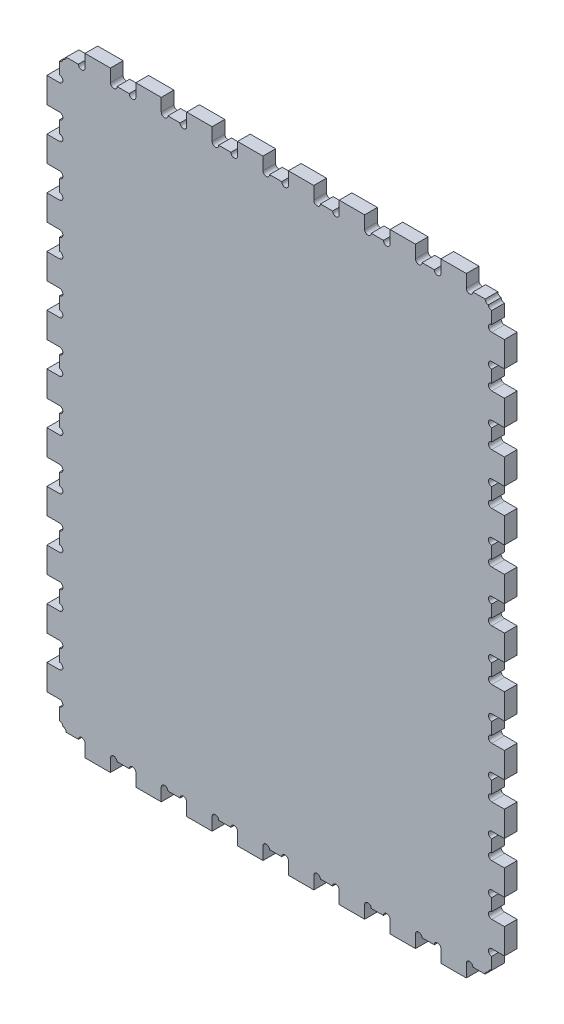
from build123d import *

# Parameters (mm, degrees)
SKETCH1_W                = 457.2
SKETCH1_H                = 609.6
BOSS_EXTRUDE1_DEPTH      = 12.7
CUT_EXTRUDE1_DEPTH       = 382.211607903
LPATTERN1_COUNT          = 9
LPATTERN1_PITCH          = 50.8
SKETCH6_W                = 12.7
SKETCH6_H                = 12.7
CUT_EXTRUDE4_DEPTH       = 382.211607903
SKETCH3_R                = 3.302
SKETCH3_W                = 12.7
SKETCH3_H                = 25.4
CUT_EXTRUDE2_DEPTH       = 382.211607903
LPATTERN2_COUNT          = 12
LPATTERN2_PITCH          = 50.8
MIRROR7_COPY_1_SKETCH_W  = 12.7
MIRROR7_COPY_1_SKETCH_H  = 12.7
MIRROR7_COPY_1_DEPTH     = 382.211607903
MIRROR1_COPY_1_SKETCH_R  = 3.302
MIRROR1_COPY_1_SKETCH_W  = 12.7
MIRROR1_COPY_1_SKETCH_H  = 25.4
MIRROR1_COPY_1_DEPTH     = 382.211607903
MIRROR1_COPY_2_SKETCH_R  = 3.302
MIRROR1_COPY_2_SKETCH_W  = 12.7
MIRROR1_COPY_2_SKETCH_H  = 25.4
MIRROR1_COPY_2_DEPTH     = 382.211607903
MIRROR1_COPY_3_SKETCH_R  = 3.302
MIRROR1_COPY_3_SKETCH_W  = 12.7
MIRROR1_COPY_3_SKETCH_H  = 25.4
MIRROR1_COPY_3_DEPTH     = 382.211607903
MIRROR1_COPY_4_SKETCH_R  = 3.302
MIRROR1_COPY_4_SKETCH_W  = 12.7
MIRROR1_COPY_4_SKETCH_H  = 25.4
MIRROR1_COPY_4_DEPTH     = 382.211607903
MIRROR1_COPY_5_SKETCH_R  = 3.302
MIRROR1_COPY_5_SKETCH_W  = 12.7
MIRROR1_COPY_5_SKETCH_H  = 25.4
MIRROR1_COPY_5_DEPTH     = 382.211607903
MIRROR1_COPY_6_SKETCH_R  = 3.302
MIRROR1_COPY_6_SKETCH_W  = 12.7
MIRROR1_COPY_6_SKETCH_H  = 25.4
MIRROR1_COPY_6_DEPTH     = 382.211607903
MIRROR1_COPY_7_SKETCH_R  = 3.302
MIRROR1_COPY_7_SKETCH_W  = 12.7
MIRROR1_COPY_7_SKETCH_H  = 25.4
MIRROR1_COPY_7_DEPTH     = 382.211607903
MIRROR1_COPY_8_SKETCH_R  = 3.302
MIRROR1_COPY_8_SKETCH_W  = 12.7
MIRROR1_COPY_8_SKETCH_H  = 25.4
MIRROR1_COPY_8_DEPTH     = 382.211607903
MIRROR1_COPY_9_SKETCH_R  = 3.302
MIRROR1_COPY_9_SKETCH_W  = 12.7
MIRROR1_COPY_9_SKETCH_H  = 25.4
MIRROR1_COPY_9_DEPTH     = 382.211607903
MIRROR1_COPY_10_SKETCH_R = 3.302
MIRROR1_COPY_10_SKETCH_W = 12.7
MIRROR1_COPY_10_SKETCH_H = 25.4
MIRROR1_COPY_10_DEPTH    = 382.211607903
MIRROR1_COPY_11_SKETCH_R = 3.302
MIRROR1_COPY_11_SKETCH_W = 12.7
MIRROR1_COPY_11_SKETCH_H = 25.4
MIRROR1_COPY_11_DEPTH    = 382.211607903
MIRROR2_COPY_1_DEPTH     = 382.211607903
MIRROR2_COPY_2_DEPTH     = 382.211607903
MIRROR2_COPY_3_DEPTH     = 382.211607903
MIRROR2_COPY_4_DEPTH     = 382.211607903
MIRROR2_COPY_5_DEPTH     = 382.211607903
MIRROR2_COPY_6_DEPTH     = 382.211607903
MIRROR2_COPY_7_DEPTH     = 382.211607903
MIRROR2_COPY_8_DEPTH     = 382.211607903
SKETCH5_W                = 25.4
SKETCH5_H                = 12.7
SKETCH5_W_2              = 12.7
SKETCH5_H_2              = 25.4
CUT_EXTRUDE3_DEPTH       = 382.211607903


with BuildPart() as part:
    # Sketch1 → Boss-Extrude1 (new body)
    with BuildSketch(Plane.XY):
        Rectangle(SKETCH1_W, SKETCH1_H)
    extrude(amount=BOSS_EXTRUDE1_DEPTH)

    # Sketch2 → Cut-Extrude1 (cut, through all)
    with BuildSketch(Plane.XY.offset(12.7)):
        with BuildLine():
            Line((-190.5, 304.8), (-215.9, 304.8))
            Line((-215.9, 304.8), (-215.9, 292.1))
            ThreePointArc((-215.9, 292.1), (-212.598, 295.402), (-209.296, 292.1))
            Line((-209.296, 292.1), (-197.104, 292.1))
            ThreePointArc((-197.104, 292.1), (-193.802, 295.402), (-190.5, 292.1))
            Line((-190.5, 292.1), (-190.5, 304.8))
        make_face()
        with BuildLine():
            ThreePointArc((-209.296, 292.1), (-212.598, 295.402), (-215.9, 292.1))
            Line((-215.9, 292.1), (-209.296, 292.1))
        make_face()
        with BuildLine():
            Line((-209.296, 292.1), (-215.9, 292.1))
            ThreePointArc((-215.9, 292.1), (-212.598, 288.798), (-209.296, 292.1))
        make_face()
        with BuildLine():
            ThreePointArc((-197.104, 292.1), (-193.802, 288.798), (-190.5, 292.1))
            Line((-190.5, 292.1), (-197.104, 292.1))
        make_face()
        with BuildLine():
            Line((-197.104, 292.1), (-190.5, 292.1))
            ThreePointArc((-190.5, 292.1), (-193.802, 295.402), (-197.104, 292.1))
        make_face()
    cut_extrude1 = extrude(amount=-CUT_EXTRUDE1_DEPTH, mode=Mode.SUBTRACT)

    # LPattern1: Cut-Extrude1 ×9
    with Locations(*[(i * LPATTERN1_PITCH, 0, 0) for i in range(1, LPATTERN1_COUNT)]):
        add(cut_extrude1, mode=Mode.SUBTRACT)

    # Sketch6 → Cut-Extrude4 (cut, through all)
    with BuildSketch(Plane.XY.offset(12.7)):
        with Locations((-222.25, 298.45)):
            Rectangle(SKETCH6_W, SKETCH6_H)
    cut_extrude4 = extrude(amount=-CUT_EXTRUDE4_DEPTH, mode=Mode.SUBTRACT)

    # Sketch3 → Cut-Extrude2 (cut, through all)
    with BuildSketch(Plane.XY.offset(12.7)):
        with Locations((-215.9, 270.002)):
            Circle(SKETCH3_R)
        with Locations((-215.9, 288.798)):
            Circle(SKETCH3_R)
        with Locations((-222.25, 279.4)):
            Rectangle(SKETCH3_W, SKETCH3_H)
        with BuildLine():
            ThreePointArc((-212.598, 288.798), (-213.565133409, 291.132866591), (-215.9, 292.1))
            Line((-215.9, 292.1), (-215.9, 285.496))
            ThreePointArc((-215.9, 285.496), (-213.565133409, 286.463133409), (-212.598, 288.798))
        make_face()
        with BuildLine():
            Line((-215.9, 285.496), (-215.9, 292.1))
            ThreePointArc((-215.9, 292.1), (-219.202, 288.798), (-215.9, 285.496))
        make_face()
        with BuildLine():
            ThreePointArc((-215.9, 273.304), (-219.202, 270.002), (-215.9, 266.7))
            Line((-215.9, 266.7), (-215.9, 273.304))
        make_face()
        with BuildLine():
            Line((-215.9, 273.304), (-215.9, 266.7))
            ThreePointArc((-215.9, 266.7), (-213.565133409, 267.667133409), (-212.598, 270.002))
            ThreePointArc((-212.598, 270.002), (-213.565133409, 272.336866591), (-215.9, 273.304))
        make_face()
    cut_extrude2 = extrude(amount=-CUT_EXTRUDE2_DEPTH, mode=Mode.SUBTRACT)

    # LPattern2: Cut-Extrude2 ×12
    with Locations(*[(0, -i * LPATTERN2_PITCH, 0) for i in range(1, LPATTERN2_COUNT)]):
        add(cut_extrude2, mode=Mode.SUBTRACT)

    # Mirror6: Cut-Extrude4 across plane
    add(cut_extrude4.mirror(Plane(origin=(0, 0, 0), x_dir=(0, 0, 1), z_dir=(1, 0, 0))), mode=Mode.SUBTRACT)

    # Mirror7: Cut-Extrude4 across plane
    add(cut_extrude4.mirror(Plane.ZX), mode=Mode.SUBTRACT)

    # Mirror7 copy 1 sketch → Mirror7 copy 1 (cut, through all)
    with BuildSketch(Plane(origin=(0, 0, 12.7), x_dir=(-1, 0, 0), z_dir=(0, 0, 1))):
        with Locations((-222.25, 298.45)):
            Rectangle(MIRROR7_COPY_1_SKETCH_W, MIRROR7_COPY_1_SKETCH_H)
    extrude(amount=-MIRROR7_COPY_1_DEPTH, mode=Mode.SUBTRACT)

    # Mirror1: Cut-Extrude2 across plane
    add(cut_extrude2.mirror(Plane(origin=(0, 0, 0), x_dir=(0, 0, 1), z_dir=(1, 0, 0))), mode=Mode.SUBTRACT)

    # Mirror1 copy 1 sketch → Mirror1 copy 1 (cut, through all)
    with BuildSketch(Plane(origin=(0, -50.8, 12.7), x_dir=(-1, 0, 0), z_dir=(0, 0, 1))):
        with Locations((-215.9, -270.002)):
            Circle(MIRROR1_COPY_1_SKETCH_R)
        with Locations((-215.9, -288.798)):
            Circle(MIRROR1_COPY_1_SKETCH_R)
        with Locations((-222.25, -279.4)):
            Rectangle(MIRROR1_COPY_1_SKETCH_W, MIRROR1_COPY_1_SKETCH_H)
        with BuildLine():
            ThreePointArc((-212.598, -288.798), (-213.565133409, -291.132866591), (-215.9, -292.1))
            Line((-215.9, -292.1), (-215.9, -285.496))
            ThreePointArc((-215.9, -285.496), (-213.565133409, -286.463133409), (-212.598, -288.798))
        make_face()
        with BuildLine():
            Line((-215.9, -285.496), (-215.9, -292.1))
            ThreePointArc((-215.9, -292.1), (-219.202, -288.798), (-215.9, -285.496))
        make_face()
        with BuildLine():
            ThreePointArc((-215.9, -273.304), (-219.202, -270.002), (-215.9, -266.7))
            Line((-215.9, -266.7), (-215.9, -273.304))
        make_face()
        with BuildLine():
            Line((-215.9, -273.304), (-215.9, -266.7))
            ThreePointArc((-215.9, -266.7), (-213.565133409, -267.667133409), (-212.598, -270.002))
            ThreePointArc((-212.598, -270.002), (-213.565133409, -272.336866591), (-215.9, -273.304))
        make_face()
    extrude(amount=-MIRROR1_COPY_1_DEPTH, mode=Mode.SUBTRACT)

    # Mirror1 copy 2 sketch → Mirror1 copy 2 (cut, through all)
    with BuildSketch(Plane(origin=(0, -101.6, 12.7), x_dir=(-1, 0, 0), z_dir=(0, 0, 1))):
        with Locations((-215.9, -270.002)):
            Circle(MIRROR1_COPY_2_SKETCH_R)
        with Locations((-215.9, -288.798)):
            Circle(MIRROR1_COPY_2_SKETCH_R)
        with Locations((-222.25, -279.4)):
            Rectangle(MIRROR1_COPY_2_SKETCH_W, MIRROR1_COPY_2_SKETCH_H)
        with BuildLine():
            ThreePointArc((-212.598, -288.798), (-213.565133409, -291.132866591), (-215.9, -292.1))
            Line((-215.9, -292.1), (-215.9, -285.496))
            ThreePointArc((-215.9, -285.496), (-213.565133409, -286.463133409), (-212.598, -288.798))
        make_face()
        with BuildLine():
            Line((-215.9, -285.496), (-215.9, -292.1))
            ThreePointArc((-215.9, -292.1), (-219.202, -288.798), (-215.9, -285.496))
        make_face()
        with BuildLine():
            ThreePointArc((-215.9, -273.304), (-219.202, -270.002), (-215.9, -266.7))
            Line((-215.9, -266.7), (-215.9, -273.304))
        make_face()
        with BuildLine():
            Line((-215.9, -273.304), (-215.9, -266.7))
            ThreePointArc((-215.9, -266.7), (-213.565133409, -267.667133409), (-212.598, -270.002))
            ThreePointArc((-212.598, -270.002), (-213.565133409, -272.336866591), (-215.9, -273.304))
        make_face()
    extrude(amount=-MIRROR1_COPY_2_DEPTH, mode=Mode.SUBTRACT)

    # Mirror1 copy 3 sketch → Mirror1 copy 3 (cut, through all)
    with BuildSketch(Plane(origin=(0, -152.4, 12.7), x_dir=(-1, 0, 0), z_dir=(0, 0, 1))):
        with Locations((-215.9, -270.002)):
            Circle(MIRROR1_COPY_3_SKETCH_R)
        with Locations((-215.9, -288.798)):
            Circle(MIRROR1_COPY_3_SKETCH_R)
        with Locations((-222.25, -279.4)):
            Rectangle(MIRROR1_COPY_3_SKETCH_W, MIRROR1_COPY_3_SKETCH_H)
        with BuildLine():
            ThreePointArc((-212.598, -288.798), (-213.565133409, -291.132866591), (-215.9, -292.1))
            Line((-215.9, -292.1), (-215.9, -285.496))
            ThreePointArc((-215.9, -285.496), (-213.565133409, -286.463133409), (-212.598, -288.798))
        make_face()
        with BuildLine():
            Line((-215.9, -285.496), (-215.9, -292.1))
            ThreePointArc((-215.9, -292.1), (-219.202, -288.798), (-215.9, -285.496))
        make_face()
        with BuildLine():
            ThreePointArc((-215.9, -273.304), (-219.202, -270.002), (-215.9, -266.7))
            Line((-215.9, -266.7), (-215.9, -273.304))
        make_face()
        with BuildLine():
            Line((-215.9, -273.304), (-215.9, -266.7))
            ThreePointArc((-215.9, -266.7), (-213.565133409, -267.667133409), (-212.598, -270.002))
            ThreePointArc((-212.598, -270.002), (-213.565133409, -272.336866591), (-215.9, -273.304))
        make_face()
    extrude(amount=-MIRROR1_COPY_3_DEPTH, mode=Mode.SUBTRACT)

    # Mirror1 copy 4 sketch → Mirror1 copy 4 (cut, through all)
    with BuildSketch(Plane(origin=(0, -203.2, 12.7), x_dir=(-1, 0, 0), z_dir=(0, 0, 1))):
        with Locations((-215.9, -270.002)):
            Circle(MIRROR1_COPY_4_SKETCH_R)
        with Locations((-215.9, -288.798)):
            Circle(MIRROR1_COPY_4_SKETCH_R)
        with Locations((-222.25, -279.4)):
            Rectangle(MIRROR1_COPY_4_SKETCH_W, MIRROR1_COPY_4_SKETCH_H)
        with BuildLine():
            ThreePointArc((-212.598, -288.798), (-213.565133409, -291.132866591), (-215.9, -292.1))
            Line((-215.9, -292.1), (-215.9, -285.496))
            ThreePointArc((-215.9, -285.496), (-213.565133409, -286.463133409), (-212.598, -288.798))
        make_face()
        with BuildLine():
            Line((-215.9, -285.496), (-215.9, -292.1))
            ThreePointArc((-215.9, -292.1), (-219.202, -288.798), (-215.9, -285.496))
        make_face()
        with BuildLine():
            ThreePointArc((-215.9, -273.304), (-219.202, -270.002), (-215.9, -266.7))
            Line((-215.9, -266.7), (-215.9, -273.304))
        make_face()
        with BuildLine():
            Line((-215.9, -273.304), (-215.9, -266.7))
            ThreePointArc((-215.9, -266.7), (-213.565133409, -267.667133409), (-212.598, -270.002))
            ThreePointArc((-212.598, -270.002), (-213.565133409, -272.336866591), (-215.9, -273.304))
        make_face()
    extrude(amount=-MIRROR1_COPY_4_DEPTH, mode=Mode.SUBTRACT)

    # Mirror1 copy 5 sketch → Mirror1 copy 5 (cut, through all)
    with BuildSketch(Plane(origin=(0, -254, 12.7), x_dir=(-1, 0, 0), z_dir=(0, 0, 1))):
        with Locations((-215.9, -270.002)):
            Circle(MIRROR1_COPY_5_SKETCH_R)
        with Locations((-215.9, -288.798)):
            Circle(MIRROR1_COPY_5_SKETCH_R)
        with Locations((-222.25, -279.4)):
            Rectangle(MIRROR1_COPY_5_SKETCH_W, MIRROR1_COPY_5_SKETCH_H)
        with BuildLine():
            ThreePointArc((-212.598, -288.798), (-213.565133409, -291.132866591), (-215.9, -292.1))
            Line((-215.9, -292.1), (-215.9, -285.496))
            ThreePointArc((-215.9, -285.496), (-213.565133409, -286.463133409), (-212.598, -288.798))
        make_face()
        with BuildLine():
            Line((-215.9, -285.496), (-215.9, -292.1))
            ThreePointArc((-215.9, -292.1), (-219.202, -288.798), (-215.9, -285.496))
        make_face()
        with BuildLine():
            ThreePointArc((-215.9, -273.304), (-219.202, -270.002), (-215.9, -266.7))
            Line((-215.9, -266.7), (-215.9, -273.304))
        make_face()
        with BuildLine():
            Line((-215.9, -273.304), (-215.9, -266.7))
            ThreePointArc((-215.9, -266.7), (-213.565133409, -267.667133409), (-212.598, -270.002))
            ThreePointArc((-212.598, -270.002), (-213.565133409, -272.336866591), (-215.9, -273.304))
        make_face()
    extrude(amount=-MIRROR1_COPY_5_DEPTH, mode=Mode.SUBTRACT)

    # Mirror1 copy 6 sketch → Mirror1 copy 6 (cut, through all)
    with BuildSketch(Plane(origin=(0, -304.8, 12.7), x_dir=(-1, 0, 0), z_dir=(0, 0, 1))):
        with Locations((-215.9, -270.002)):
            Circle(MIRROR1_COPY_6_SKETCH_R)
        with Locations((-215.9, -288.798)):
            Circle(MIRROR1_COPY_6_SKETCH_R)
        with Locations((-222.25, -279.4)):
            Rectangle(MIRROR1_COPY_6_SKETCH_W, MIRROR1_COPY_6_SKETCH_H)
        with BuildLine():
            ThreePointArc((-212.598, -288.798), (-213.565133409, -291.132866591), (-215.9, -292.1))
            Line((-215.9, -292.1), (-215.9, -285.496))
            ThreePointArc((-215.9, -285.496), (-213.565133409, -286.463133409), (-212.598, -288.798))
        make_face()
        with BuildLine():
            Line((-215.9, -285.496), (-215.9, -292.1))
            ThreePointArc((-215.9, -292.1), (-219.202, -288.798), (-215.9, -285.496))
        make_face()
        with BuildLine():
            ThreePointArc((-215.9, -273.304), (-219.202, -270.002), (-215.9, -266.7))
            Line((-215.9, -266.7), (-215.9, -273.304))
        make_face()
        with BuildLine():
            Line((-215.9, -273.304), (-215.9, -266.7))
            ThreePointArc((-215.9, -266.7), (-213.565133409, -267.667133409), (-212.598, -270.002))
            ThreePointArc((-212.598, -270.002), (-213.565133409, -272.336866591), (-215.9, -273.304))
        make_face()
    extrude(amount=-MIRROR1_COPY_6_DEPTH, mode=Mode.SUBTRACT)

    # Mirror1 copy 7 sketch → Mirror1 copy 7 (cut, through all)
    with BuildSketch(Plane(origin=(0, -355.6, 12.7), x_dir=(-1, 0, 0), z_dir=(0, 0, 1))):
        with Locations((-215.9, -270.002)):
            Circle(MIRROR1_COPY_7_SKETCH_R)
        with Locations((-215.9, -288.798)):
            Circle(MIRROR1_COPY_7_SKETCH_R)
        with Locations((-222.25, -279.4)):
            Rectangle(MIRROR1_COPY_7_SKETCH_W, MIRROR1_COPY_7_SKETCH_H)
        with BuildLine():
            ThreePointArc((-212.598, -288.798), (-213.565133409, -291.132866591), (-215.9, -292.1))
            Line((-215.9, -292.1), (-215.9, -285.496))
            ThreePointArc((-215.9, -285.496), (-213.565133409, -286.463133409), (-212.598, -288.798))
        make_face()
        with BuildLine():
            Line((-215.9, -285.496), (-215.9, -292.1))
            ThreePointArc((-215.9, -292.1), (-219.202, -288.798), (-215.9, -285.496))
        make_face()
        with BuildLine():
            ThreePointArc((-215.9, -273.304), (-219.202, -270.002), (-215.9, -266.7))
            Line((-215.9, -266.7), (-215.9, -273.304))
        make_face()
        with BuildLine():
            Line((-215.9, -273.304), (-215.9, -266.7))
            ThreePointArc((-215.9, -266.7), (-213.565133409, -267.667133409), (-212.598, -270.002))
            ThreePointArc((-212.598, -270.002), (-213.565133409, -272.336866591), (-215.9, -273.304))
        make_face()
    extrude(amount=-MIRROR1_COPY_7_DEPTH, mode=Mode.SUBTRACT)

    # Mirror1 copy 8 sketch → Mirror1 copy 8 (cut, through all)
    with BuildSketch(Plane(origin=(0, -406.4, 12.7), x_dir=(-1, 0, 0), z_dir=(0, 0, 1))):
        with Locations((-215.9, -270.002)):
            Circle(MIRROR1_COPY_8_SKETCH_R)
        with Locations((-215.9, -288.798)):
            Circle(MIRROR1_COPY_8_SKETCH_R)
        with Locations((-222.25, -279.4)):
            Rectangle(MIRROR1_COPY_8_SKETCH_W, MIRROR1_COPY_8_SKETCH_H)
        with BuildLine():
            ThreePointArc((-212.598, -288.798), (-213.565133409, -291.132866591), (-215.9, -292.1))
            Line((-215.9, -292.1), (-215.9, -285.496))
            ThreePointArc((-215.9, -285.496), (-213.565133409, -286.463133409), (-212.598, -288.798))
        make_face()
        with BuildLine():
            Line((-215.9, -285.496), (-215.9, -292.1))
            ThreePointArc((-215.9, -292.1), (-219.202, -288.798), (-215.9, -285.496))
        make_face()
        with BuildLine():
            ThreePointArc((-215.9, -273.304), (-219.202, -270.002), (-215.9, -266.7))
            Line((-215.9, -266.7), (-215.9, -273.304))
        make_face()
        with BuildLine():
            Line((-215.9, -273.304), (-215.9, -266.7))
            ThreePointArc((-215.9, -266.7), (-213.565133409, -267.667133409), (-212.598, -270.002))
            ThreePointArc((-212.598, -270.002), (-213.565133409, -272.336866591), (-215.9, -273.304))
        make_face()
    extrude(amount=-MIRROR1_COPY_8_DEPTH, mode=Mode.SUBTRACT)

    # Mirror1 copy 9 sketch → Mirror1 copy 9 (cut, through all)
    with BuildSketch(Plane(origin=(0, -457.2, 12.7), x_dir=(-1, 0, 0), z_dir=(0, 0, 1))):
        with Locations((-215.9, -270.002)):
            Circle(MIRROR1_COPY_9_SKETCH_R)
        with Locations((-215.9, -288.798)):
            Circle(MIRROR1_COPY_9_SKETCH_R)
        with Locations((-222.25, -279.4)):
            Rectangle(MIRROR1_COPY_9_SKETCH_W, MIRROR1_COPY_9_SKETCH_H)
        with BuildLine():
            ThreePointArc((-212.598, -288.798), (-213.565133409, -291.132866591), (-215.9, -292.1))
            Line((-215.9, -292.1), (-215.9, -285.496))
            ThreePointArc((-215.9, -285.496), (-213.565133409, -286.463133409), (-212.598, -288.798))
        make_face()
        with BuildLine():
            Line((-215.9, -285.496), (-215.9, -292.1))
            ThreePointArc((-215.9, -292.1), (-219.202, -288.798), (-215.9, -285.496))
        make_face()
        with BuildLine():
            ThreePointArc((-215.9, -273.304), (-219.202, -270.002), (-215.9, -266.7))
            Line((-215.9, -266.7), (-215.9, -273.304))
        make_face()
        with BuildLine():
            Line((-215.9, -273.304), (-215.9, -266.7))
            ThreePointArc((-215.9, -266.7), (-213.565133409, -267.667133409), (-212.598, -270.002))
            ThreePointArc((-212.598, -270.002), (-213.565133409, -272.336866591), (-215.9, -273.304))
        make_face()
    extrude(amount=-MIRROR1_COPY_9_DEPTH, mode=Mode.SUBTRACT)

    # Mirror1 copy 10 sketch → Mirror1 copy 10 (cut, through all)
    with BuildSketch(Plane(origin=(0, -508, 12.7), x_dir=(-1, 0, 0), z_dir=(0, 0, 1))):
        with Locations((-215.9, -270.002)):
            Circle(MIRROR1_COPY_10_SKETCH_R)
        with Locations((-215.9, -288.798)):
            Circle(MIRROR1_COPY_10_SKETCH_R)
        with Locations((-222.25, -279.4)):
            Rectangle(MIRROR1_COPY_10_SKETCH_W, MIRROR1_COPY_10_SKETCH_H)
        with BuildLine():
            ThreePointArc((-212.598, -288.798), (-213.565133409, -291.132866591), (-215.9, -292.1))
            Line((-215.9, -292.1), (-215.9, -285.496))
            ThreePointArc((-215.9, -285.496), (-213.565133409, -286.463133409), (-212.598, -288.798))
        make_face()
        with BuildLine():
            Line((-215.9, -285.496), (-215.9, -292.1))
            ThreePointArc((-215.9, -292.1), (-219.202, -288.798), (-215.9, -285.496))
        make_face()
        with BuildLine():
            ThreePointArc((-215.9, -273.304), (-219.202, -270.002), (-215.9, -266.7))
            Line((-215.9, -266.7), (-215.9, -273.304))
        make_face()
        with BuildLine():
            Line((-215.9, -273.304), (-215.9, -266.7))
            ThreePointArc((-215.9, -266.7), (-213.565133409, -267.667133409), (-212.598, -270.002))
            ThreePointArc((-212.598, -270.002), (-213.565133409, -272.336866591), (-215.9, -273.304))
        make_face()
    extrude(amount=-MIRROR1_COPY_10_DEPTH, mode=Mode.SUBTRACT)

    # Mirror1 copy 11 sketch → Mirror1 copy 11 (cut, through all)
    with BuildSketch(Plane(origin=(0, -558.8, 12.7), x_dir=(-1, 0, 0), z_dir=(0, 0, 1))):
        with Locations((-215.9, -270.002)):
            Circle(MIRROR1_COPY_11_SKETCH_R)
        with Locations((-215.9, -288.798)):
            Circle(MIRROR1_COPY_11_SKETCH_R)
        with Locations((-222.25, -279.4)):
            Rectangle(MIRROR1_COPY_11_SKETCH_W, MIRROR1_COPY_11_SKETCH_H)
        with BuildLine():
            ThreePointArc((-212.598, -288.798), (-213.565133409, -291.132866591), (-215.9, -292.1))
            Line((-215.9, -292.1), (-215.9, -285.496))
            ThreePointArc((-215.9, -285.496), (-213.565133409, -286.463133409), (-212.598, -288.798))
        make_face()
        with BuildLine():
            Line((-215.9, -285.496), (-215.9, -292.1))
            ThreePointArc((-215.9, -292.1), (-219.202, -288.798), (-215.9, -285.496))
        make_face()
        with BuildLine():
            ThreePointArc((-215.9, -273.304), (-219.202, -270.002), (-215.9, -266.7))
            Line((-215.9, -266.7), (-215.9, -273.304))
        make_face()
        with BuildLine():
            Line((-215.9, -273.304), (-215.9, -266.7))
            ThreePointArc((-215.9, -266.7), (-213.565133409, -267.667133409), (-212.598, -270.002))
            ThreePointArc((-212.598, -270.002), (-213.565133409, -272.336866591), (-215.9, -273.304))
        make_face()
    extrude(amount=-MIRROR1_COPY_11_DEPTH, mode=Mode.SUBTRACT)

    # Mirror2: Cut-Extrude1 across plane
    add(cut_extrude1.mirror(Plane.ZX), mode=Mode.SUBTRACT)

    # Mirror2 copy 1 sketch → Mirror2 copy 1 (cut, through all)
    with BuildSketch(Plane(origin=(50.8, 0, 12.7), x_dir=(1, 0, 0), z_dir=(0, 0, 1))):
        with BuildLine():
            Line((-190.5, -304.8), (-215.9, -304.8))
            Line((-215.9, -304.8), (-215.9, -292.1))
            ThreePointArc((-215.9, -292.1), (-212.598, -295.402), (-209.296, -292.1))
            Line((-209.296, -292.1), (-197.104, -292.1))
            ThreePointArc((-197.104, -292.1), (-193.802, -295.402), (-190.5, -292.1))
            Line((-190.5, -292.1), (-190.5, -304.8))
        make_face()
        with BuildLine():
            ThreePointArc((-209.296, -292.1), (-212.598, -295.402), (-215.9, -292.1))
            Line((-215.9, -292.1), (-209.296, -292.1))
        make_face()
        with BuildLine():
            Line((-209.296, -292.1), (-215.9, -292.1))
            ThreePointArc((-215.9, -292.1), (-212.598, -288.798), (-209.296, -292.1))
        make_face()
        with BuildLine():
            ThreePointArc((-197.104, -292.1), (-193.802, -288.798), (-190.5, -292.1))
            Line((-190.5, -292.1), (-197.104, -292.1))
        make_face()
        with BuildLine():
            Line((-197.104, -292.1), (-190.5, -292.1))
            ThreePointArc((-190.5, -292.1), (-193.802, -295.402), (-197.104, -292.1))
        make_face()
    extrude(amount=-MIRROR2_COPY_1_DEPTH, mode=Mode.SUBTRACT)

    # Mirror2 copy 2 sketch → Mirror2 copy 2 (cut, through all)
    with BuildSketch(Plane(origin=(101.6, 0, 12.7), x_dir=(1, 0, 0), z_dir=(0, 0, 1))):
        with BuildLine():
            Line((-190.5, -304.8), (-215.9, -304.8))
            Line((-215.9, -304.8), (-215.9, -292.1))
            ThreePointArc((-215.9, -292.1), (-212.598, -295.402), (-209.296, -292.1))
            Line((-209.296, -292.1), (-197.104, -292.1))
            ThreePointArc((-197.104, -292.1), (-193.802, -295.402), (-190.5, -292.1))
            Line((-190.5, -292.1), (-190.5, -304.8))
        make_face()
        with BuildLine():
            ThreePointArc((-209.296, -292.1), (-212.598, -295.402), (-215.9, -292.1))
            Line((-215.9, -292.1), (-209.296, -292.1))
        make_face()
        with BuildLine():
            Line((-209.296, -292.1), (-215.9, -292.1))
            ThreePointArc((-215.9, -292.1), (-212.598, -288.798), (-209.296, -292.1))
        make_face()
        with BuildLine():
            ThreePointArc((-197.104, -292.1), (-193.802, -288.798), (-190.5, -292.1))
            Line((-190.5, -292.1), (-197.104, -292.1))
        make_face()
        with BuildLine():
            Line((-197.104, -292.1), (-190.5, -292.1))
            ThreePointArc((-190.5, -292.1), (-193.802, -295.402), (-197.104, -292.1))
        make_face()
    extrude(amount=-MIRROR2_COPY_2_DEPTH, mode=Mode.SUBTRACT)

    # Mirror2 copy 3 sketch → Mirror2 copy 3 (cut, through all)
    with BuildSketch(Plane(origin=(152.4, 0, 12.7), x_dir=(1, 0, 0), z_dir=(0, 0, 1))):
        with BuildLine():
            Line((-190.5, -304.8), (-215.9, -304.8))
            Line((-215.9, -304.8), (-215.9, -292.1))
            ThreePointArc((-215.9, -292.1), (-212.598, -295.402), (-209.296, -292.1))
            Line((-209.296, -292.1), (-197.104, -292.1))
            ThreePointArc((-197.104, -292.1), (-193.802, -295.402), (-190.5, -292.1))
            Line((-190.5, -292.1), (-190.5, -304.8))
        make_face()
        with BuildLine():
            ThreePointArc((-209.296, -292.1), (-212.598, -295.402), (-215.9, -292.1))
            Line((-215.9, -292.1), (-209.296, -292.1))
        make_face()
        with BuildLine():
            Line((-209.296, -292.1), (-215.9, -292.1))
            ThreePointArc((-215.9, -292.1), (-212.598, -288.798), (-209.296, -292.1))
        make_face()
        with BuildLine():
            ThreePointArc((-197.104, -292.1), (-193.802, -288.798), (-190.5, -292.1))
            Line((-190.5, -292.1), (-197.104, -292.1))
        make_face()
        with BuildLine():
            Line((-197.104, -292.1), (-190.5, -292.1))
            ThreePointArc((-190.5, -292.1), (-193.802, -295.402), (-197.104, -292.1))
        make_face()
    extrude(amount=-MIRROR2_COPY_3_DEPTH, mode=Mode.SUBTRACT)

    # Mirror2 copy 4 sketch → Mirror2 copy 4 (cut, through all)
    with BuildSketch(Plane(origin=(203.2, 0, 12.7), x_dir=(1, 0, 0), z_dir=(0, 0, 1))):
        with BuildLine():
            Line((-190.5, -304.8), (-215.9, -304.8))
            Line((-215.9, -304.8), (-215.9, -292.1))
            ThreePointArc((-215.9, -292.1), (-212.598, -295.402), (-209.296, -292.1))
            Line((-209.296, -292.1), (-197.104, -292.1))
            ThreePointArc((-197.104, -292.1), (-193.802, -295.402), (-190.5, -292.1))
            Line((-190.5, -292.1), (-190.5, -304.8))
        make_face()
        with BuildLine():
            ThreePointArc((-209.296, -292.1), (-212.598, -295.402), (-215.9, -292.1))
            Line((-215.9, -292.1), (-209.296, -292.1))
        make_face()
        with BuildLine():
            Line((-209.296, -292.1), (-215.9, -292.1))
            ThreePointArc((-215.9, -292.1), (-212.598, -288.798), (-209.296, -292.1))
        make_face()
        with BuildLine():
            ThreePointArc((-197.104, -292.1), (-193.802, -288.798), (-190.5, -292.1))
            Line((-190.5, -292.1), (-197.104, -292.1))
        make_face()
        with BuildLine():
            Line((-197.104, -292.1), (-190.5, -292.1))
            ThreePointArc((-190.5, -292.1), (-193.802, -295.402), (-197.104, -292.1))
        make_face()
    extrude(amount=-MIRROR2_COPY_4_DEPTH, mode=Mode.SUBTRACT)

    # Mirror2 copy 5 sketch → Mirror2 copy 5 (cut, through all)
    with BuildSketch(Plane(origin=(254, 0, 12.7), x_dir=(1, 0, 0), z_dir=(0, 0, 1))):
        with BuildLine():
            Line((-190.5, -304.8), (-215.9, -304.8))
            Line((-215.9, -304.8), (-215.9, -292.1))
            ThreePointArc((-215.9, -292.1), (-212.598, -295.402), (-209.296, -292.1))
            Line((-209.296, -292.1), (-197.104, -292.1))
            ThreePointArc((-197.104, -292.1), (-193.802, -295.402), (-190.5, -292.1))
            Line((-190.5, -292.1), (-190.5, -304.8))
        make_face()
        with BuildLine():
            ThreePointArc((-209.296, -292.1), (-212.598, -295.402), (-215.9, -292.1))
            Line((-215.9, -292.1), (-209.296, -292.1))
        make_face()
        with BuildLine():
            Line((-209.296, -292.1), (-215.9, -292.1))
            ThreePointArc((-215.9, -292.1), (-212.598, -288.798), (-209.296, -292.1))
        make_face()
        with BuildLine():
            ThreePointArc((-197.104, -292.1), (-193.802, -288.798), (-190.5, -292.1))
            Line((-190.5, -292.1), (-197.104, -292.1))
        make_face()
        with BuildLine():
            Line((-197.104, -292.1), (-190.5, -292.1))
            ThreePointArc((-190.5, -292.1), (-193.802, -295.402), (-197.104, -292.1))
        make_face()
    extrude(amount=-MIRROR2_COPY_5_DEPTH, mode=Mode.SUBTRACT)

    # Mirror2 copy 6 sketch → Mirror2 copy 6 (cut, through all)
    with BuildSketch(Plane(origin=(304.8, 0, 12.7), x_dir=(1, 0, 0), z_dir=(0, 0, 1))):
        with BuildLine():
            Line((-190.5, -304.8), (-215.9, -304.8))
            Line((-215.9, -304.8), (-215.9, -292.1))
            ThreePointArc((-215.9, -292.1), (-212.598, -295.402), (-209.296, -292.1))
            Line((-209.296, -292.1), (-197.104, -292.1))
            ThreePointArc((-197.104, -292.1), (-193.802, -295.402), (-190.5, -292.1))
            Line((-190.5, -292.1), (-190.5, -304.8))
        make_face()
        with BuildLine():
            ThreePointArc((-209.296, -292.1), (-212.598, -295.402), (-215.9, -292.1))
            Line((-215.9, -292.1), (-209.296, -292.1))
        make_face()
        with BuildLine():
            Line((-209.296, -292.1), (-215.9, -292.1))
            ThreePointArc((-215.9, -292.1), (-212.598, -288.798), (-209.296, -292.1))
        make_face()
        with BuildLine():
            ThreePointArc((-197.104, -292.1), (-193.802, -288.798), (-190.5, -292.1))
            Line((-190.5, -292.1), (-197.104, -292.1))
        make_face()
        with BuildLine():
            Line((-197.104, -292.1), (-190.5, -292.1))
            ThreePointArc((-190.5, -292.1), (-193.802, -295.402), (-197.104, -292.1))
        make_face()
    extrude(amount=-MIRROR2_COPY_6_DEPTH, mode=Mode.SUBTRACT)

    # Mirror2 copy 7 sketch → Mirror2 copy 7 (cut, through all)
    with BuildSketch(Plane(origin=(355.6, 0, 12.7), x_dir=(1, 0, 0), z_dir=(0, 0, 1))):
        with BuildLine():
            Line((-190.5, -304.8), (-215.9, -304.8))
            Line((-215.9, -304.8), (-215.9, -292.1))
            ThreePointArc((-215.9, -292.1), (-212.598, -295.402), (-209.296, -292.1))
            Line((-209.296, -292.1), (-197.104, -292.1))
            ThreePointArc((-197.104, -292.1), (-193.802, -295.402), (-190.5, -292.1))
            Line((-190.5, -292.1), (-190.5, -304.8))
        make_face()
        with BuildLine():
            ThreePointArc((-209.296, -292.1), (-212.598, -295.402), (-215.9, -292.1))
            Line((-215.9, -292.1), (-209.296, -292.1))
        make_face()
        with BuildLine():
            Line((-209.296, -292.1), (-215.9, -292.1))
            ThreePointArc((-215.9, -292.1), (-212.598, -288.798), (-209.296, -292.1))
        make_face()
        with BuildLine():
            ThreePointArc((-197.104, -292.1), (-193.802, -288.798), (-190.5, -292.1))
            Line((-190.5, -292.1), (-197.104, -292.1))
        make_face()
        with BuildLine():
            Line((-197.104, -292.1), (-190.5, -292.1))
            ThreePointArc((-190.5, -292.1), (-193.802, -295.402), (-197.104, -292.1))
        make_face()
    extrude(amount=-MIRROR2_COPY_7_DEPTH, mode=Mode.SUBTRACT)

    # Mirror2 copy 8 sketch → Mirror2 copy 8 (cut, through all)
    with BuildSketch(Plane(origin=(406.4, 0, 12.7), x_dir=(1, 0, 0), z_dir=(0, 0, 1))):
        with BuildLine():
            Line((-190.5, -304.8), (-215.9, -304.8))
            Line((-215.9, -304.8), (-215.9, -292.1))
            ThreePointArc((-215.9, -292.1), (-212.598, -295.402), (-209.296, -292.1))
            Line((-209.296, -292.1), (-197.104, -292.1))
            ThreePointArc((-197.104, -292.1), (-193.802, -295.402), (-190.5, -292.1))
            Line((-190.5, -292.1), (-190.5, -304.8))
        make_face()
        with BuildLine():
            ThreePointArc((-209.296, -292.1), (-212.598, -295.402), (-215.9, -292.1))
            Line((-215.9, -292.1), (-209.296, -292.1))
        make_face()
        with BuildLine():
            Line((-209.296, -292.1), (-215.9, -292.1))
            ThreePointArc((-215.9, -292.1), (-212.598, -288.798), (-209.296, -292.1))
        make_face()
        with BuildLine():
            ThreePointArc((-197.104, -292.1), (-193.802, -288.798), (-190.5, -292.1))
            Line((-190.5, -292.1), (-197.104, -292.1))
        make_face()
        with BuildLine():
            Line((-197.104, -292.1), (-190.5, -292.1))
            ThreePointArc((-190.5, -292.1), (-193.802, -295.402), (-197.104, -292.1))
        make_face()
    extrude(amount=-MIRROR2_COPY_8_DEPTH, mode=Mode.SUBTRACT)

    # Sketch5 → Cut-Extrude3 (cut, through all)
    with BuildSketch(Plane.XY.offset(12.7)):
        with Locations((-203.2, 298.45)):
            Rectangle(SKETCH5_W, SKETCH5_H)
        with Locations((-222.25, 279.4)):
            Rectangle(SKETCH5_W_2, SKETCH5_H_2)
        with Locations((-222.25, 298.45)):
            Rectangle(SKETCH5_W_2, SKETCH5_H)
    cut_extrude3 = extrude(amount=-CUT_EXTRUDE3_DEPTH, mode=Mode.SUBTRACT)

    # Mirror3: Cut-Extrude3 across plane
    add(cut_extrude3.mirror(Plane(origin=(0, 0, 0), x_dir=(0, 0, 1), z_dir=(1, 0, 0))), mode=Mode.SUBTRACT)

    # Mirror4: Cut-Extrude3 across plane
    add(cut_extrude3.mirror(Plane.ZX), mode=Mode.SUBTRACT)

    # Mirror5: Cut-Extrude3 across plane
    add(cut_extrude3.mirror(Plane.ZX), mode=Mode.SUBTRACT)


solid = part.part
